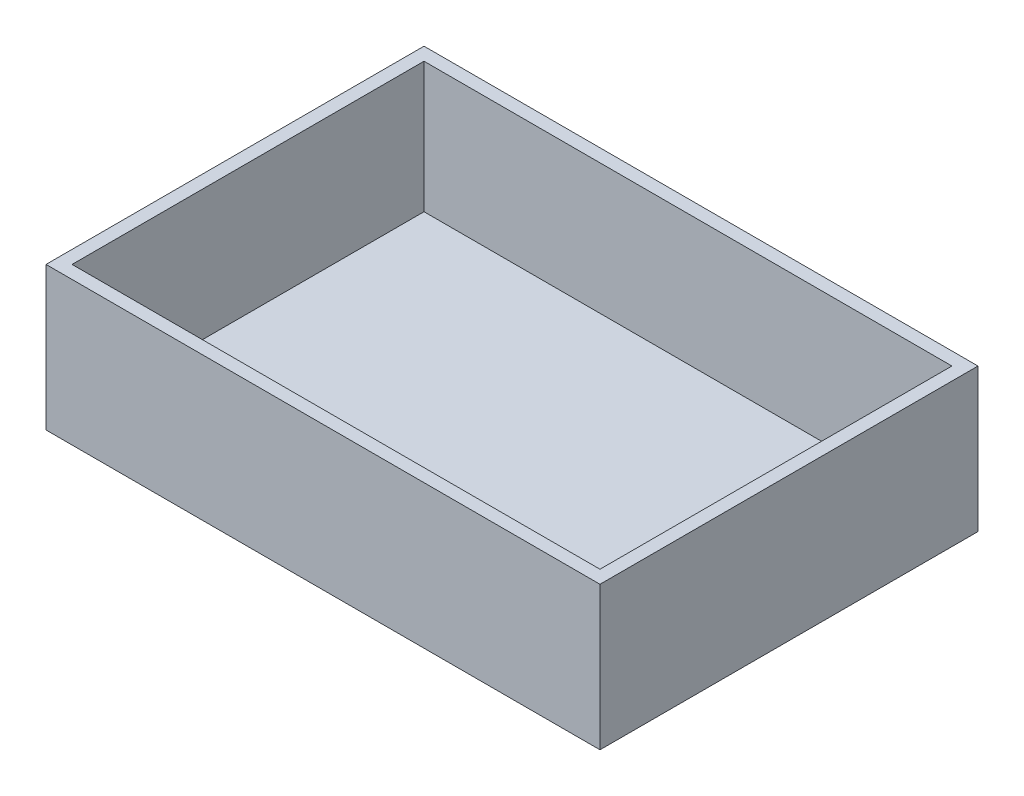
from build123d import *

# Parameters (mm, degrees)
SKETCH1_W           = 425
SKETCH1_H           = 290
SKETCH1_W_2         = 405
SKETCH1_H_2         = 270
BOSS_EXTRUDE1_DEPTH = 100
SKETCH2_W           = 425
SKETCH2_H           = 290
BOSS_EXTRUDE2_DEPTH = 10


with BuildPart() as part:
    # Sketch1 → Boss-Extrude1 (new body)
    with BuildSketch(Plane(origin=(0, 0, 0), x_dir=(1, 0, 0), z_dir=(0, 1, 0))):
        Rectangle(SKETCH1_W, SKETCH1_H)
        Rectangle(SKETCH1_W_2, SKETCH1_H_2, mode=Mode.SUBTRACT)
    extrude(amount=BOSS_EXTRUDE1_DEPTH)

    # Sketch2 → Boss-Extrude2 (add)
    with BuildSketch(Plane.XZ):
        Rectangle(SKETCH2_W, SKETCH2_H)
    extrude(amount=BOSS_EXTRUDE2_DEPTH)


solid = part.part
